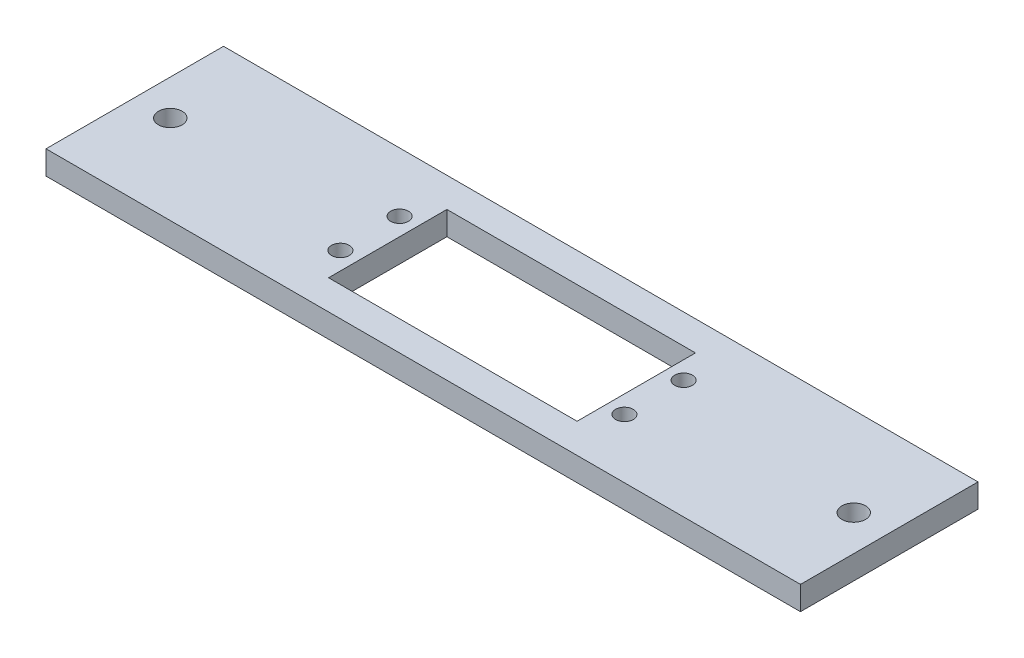
from build123d import *

# Parameters (mm, degrees)
SKETCH1_W           = 127.5
SKETCH1_H           = 30
SKETCH1_R           = 2
SKETCH1_W_2         = 42
SKETCH1_H_2         = 20
BOSS_EXTRUDE1_DEPTH = 4
SKETCH2_R           = 1.5
CUT_EXTRUDE1_DEPTH  = 66.612975089


with BuildPart() as part:
    # Sketch1 → Boss-Extrude1 (new body)
    with BuildSketch(Plane(origin=(0, 0, 0), x_dir=(1, 0, 0), z_dir=(0, 1, 0))):
        Rectangle(SKETCH1_W, SKETCH1_H)
        with Locations(Location((-57.75, 0, 0), (0, 0, 270))):
            Circle(SKETCH1_R, mode=Mode.SUBTRACT)
        with Locations(Location((57.75, 0, 0), (0, 0, 90))):
            Circle(SKETCH1_R, mode=Mode.SUBTRACT)
        Rectangle(SKETCH1_W_2, SKETCH1_H_2, mode=Mode.SUBTRACT)
    extrude(amount=BOSS_EXTRUDE1_DEPTH)

    # Sketch2 → Cut-Extrude1 (cut, through all)
    with BuildSketch(Plane(origin=(0, 4, 0), x_dir=(1, 0, 0), z_dir=(0, 1, 0))):
        with Locations(Location((-24, 5, 0), (0, 0, 270))):
            Circle(SKETCH2_R)
        with Locations(Location((-24, -5, 0), (0, 0, 90))):
            Circle(SKETCH2_R)
        with Locations(Location((24, -5, 0), (0, 0, 270))):
            Circle(SKETCH2_R)
        with Locations(Location((24, 5, 0), (0, 0, 90))):
            Circle(SKETCH2_R)
    extrude(amount=-CUT_EXTRUDE1_DEPTH, mode=Mode.SUBTRACT)


solid = part.part
